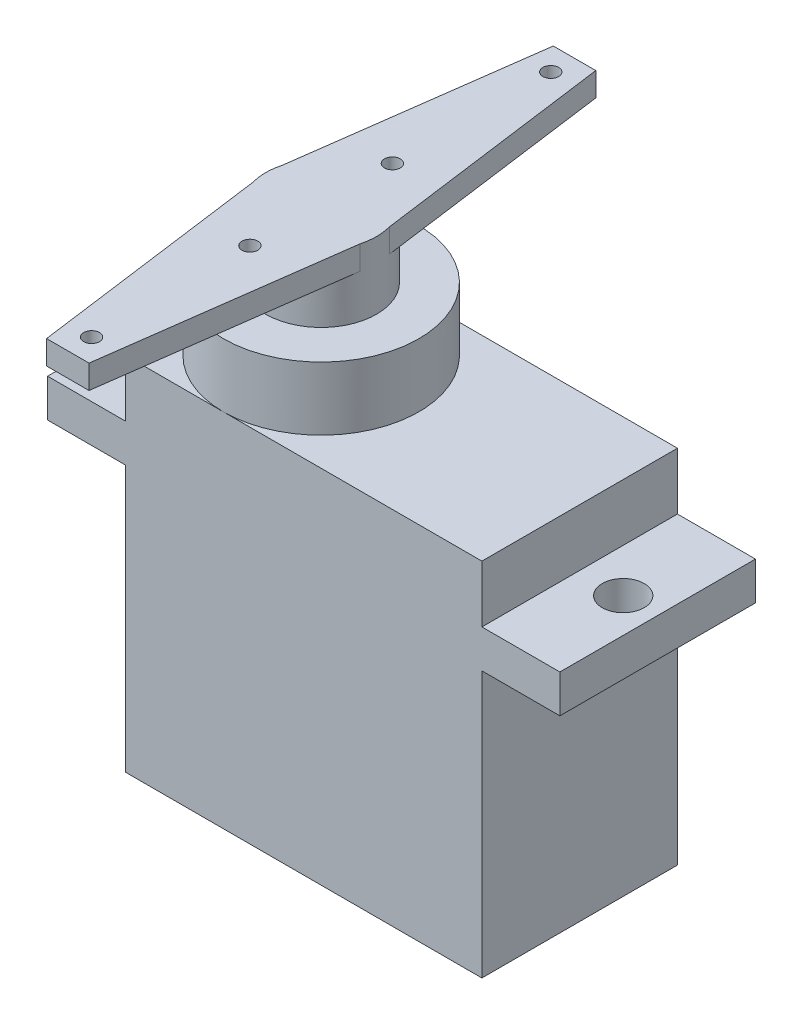
from build123d import *

# Parameters (mm, degrees)
SKETCH_1_W      = 22.5
SKETCH_1_H      = 12.35
EXTRUDE_1_DEPTH = 22.8
EXTRUDE_START   = -3.6
SKETCH_2_W      = 32.35
SKETCH_2_H      = 12.35
SKETCH_2_R      = 1.325
EXTRUDE_2_DEPTH = 2.4
SKETCH_3_R      = 6.175
EXTRUDE_3_DEPTH = 4
SKETCH_4_R      = 3.5
EXTRUDE_4_DEPTH = 4.25
SKETCH_5_R      = 0.5
EXTRUDE_5_DEPTH = 1.5


with BuildPart() as part:
    # 草图1 → 凸台-拉伸1 (new body)
    with BuildSketch(Plane(origin=(0, 0, 0), x_dir=(1, 0, 0), z_dir=(0, 1, 0))):
        Rectangle(SKETCH_1_W, SKETCH_1_H)
    extrude(amount=EXTRUDE_1_DEPTH)

    # 草图2 → 凸台-拉伸2 (add)
    with BuildSketch(Plane(origin=(0, 22.8, 0), x_dir=(1, 0, 0), z_dir=(0, 1, 0)).offset(EXTRUDE_START)):
        Rectangle(SKETCH_2_W, SKETCH_2_H)
        with Locations(Location((-14, 0, 0), (0, 0, 270))):
            Circle(SKETCH_2_R, mode=Mode.SUBTRACT)
        with Locations(Location((14, 0, 0), (0, 0, 90))):
            Circle(SKETCH_2_R, mode=Mode.SUBTRACT)
    extrude(amount=-EXTRUDE_2_DEPTH)

    # 草图3 → 凸台-拉伸3 (add)
    with BuildSketch(Plane(origin=(0, 22.8, 0), x_dir=(1, 0, 0), z_dir=(0, 1, 0))):
        with Locations(Location((-5.075, 0, 0), (0, 0, 270))):
            Circle(SKETCH_3_R)
    extrude(amount=EXTRUDE_3_DEPTH)


with BuildPart() as body_2:
    # 草图4 → 凸台-拉伸4 (new body)
    with BuildSketch(Plane(origin=(0, 26.8, 0), x_dir=(1, 0, 0), z_dir=(0, 1, 0))):
        with Locations(Location((-5.075, 0, 0), (0, 0, 270))):
            Circle(SKETCH_4_R)
    extrude(amount=EXTRUDE_4_DEPTH)

    # 草图5 → 凸台-拉伸5 (add)
    with BuildSketch(Plane(origin=(0, 31.05, 0), x_dir=(1, 0, 0), z_dir=(0, 1, 0))):
        Polygon((-8.575, 0), (-6.416535944, 16), (-3.733464056, 16), (-1.575, 0), (-3.733464056, -16), (-6.416535944, -16), align=None)
        with Locations(Location((-5.075, 14.5, 0), (0, 0, 270))):
            Circle(SKETCH_5_R, mode=Mode.SUBTRACT)
        with Locations(Location((-5.075, 4.5, 0), (0, 0, 270))):
            Circle(SKETCH_5_R, mode=Mode.SUBTRACT)
        with Locations(Location((-5.075, -4.5, 0), (0, 0, 90))):
            Circle(SKETCH_5_R, mode=Mode.SUBTRACT)
        with Locations(Location((-5.075, -14.5, 0), (0, 0, 90))):
            Circle(SKETCH_5_R, mode=Mode.SUBTRACT)
    extrude(amount=-EXTRUDE_5_DEPTH)


solid = Compound([part.part, body_2.part])
